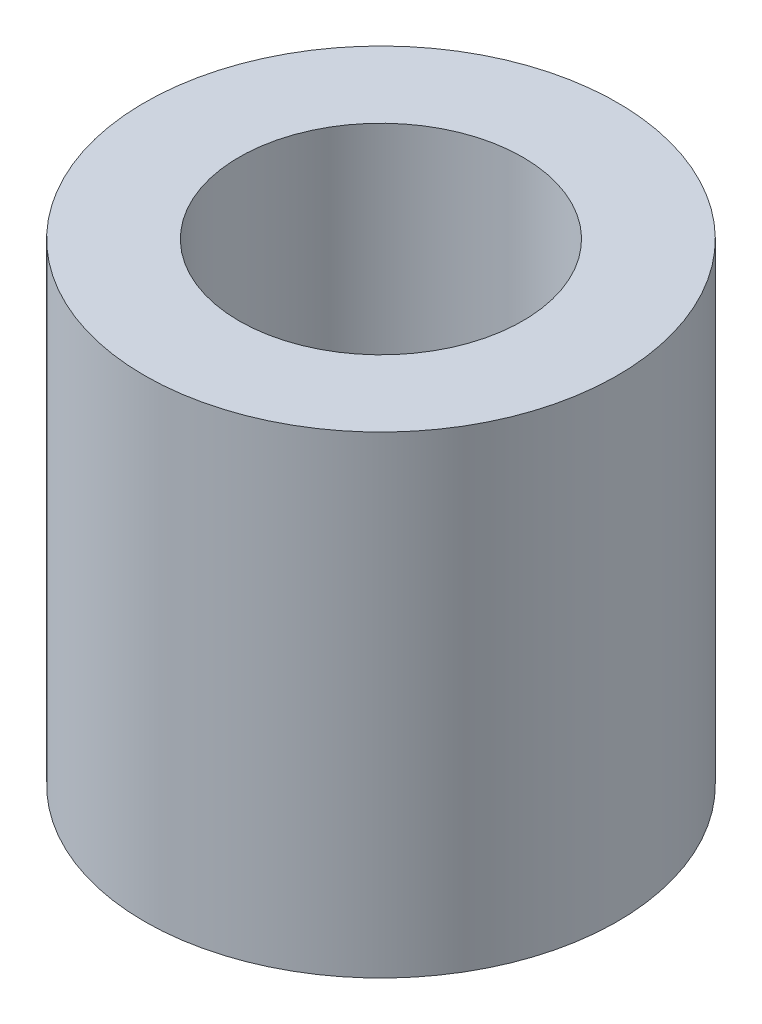
from build123d import *

# Parameters (mm, degrees)
SKETCH1_R           = 5
BOSS_EXTRUDE1_DEPTH = 10
SHELL2_T            = -2


with BuildPart() as part:
    # Sketch1 → Boss-Extrude1 (new body)
    with BuildSketch(Plane(origin=(0, 0, 0), x_dir=(1, 0, 0), z_dir=(0, 1, 0))):
        with Locations(Location((0, 0, 0), (0, 0, 270))):
            Circle(SKETCH1_R)
    extrude(amount=BOSS_EXTRUDE1_DEPTH)

    # Shell2
    shell2_openings = [part.faces().sort_by_distance(p)[0] for p in [
        (0, 10, 0),
    ]]
    offset(amount=SHELL2_T, openings=shell2_openings, kind=Kind.INTERSECTION)


solid = part.part
